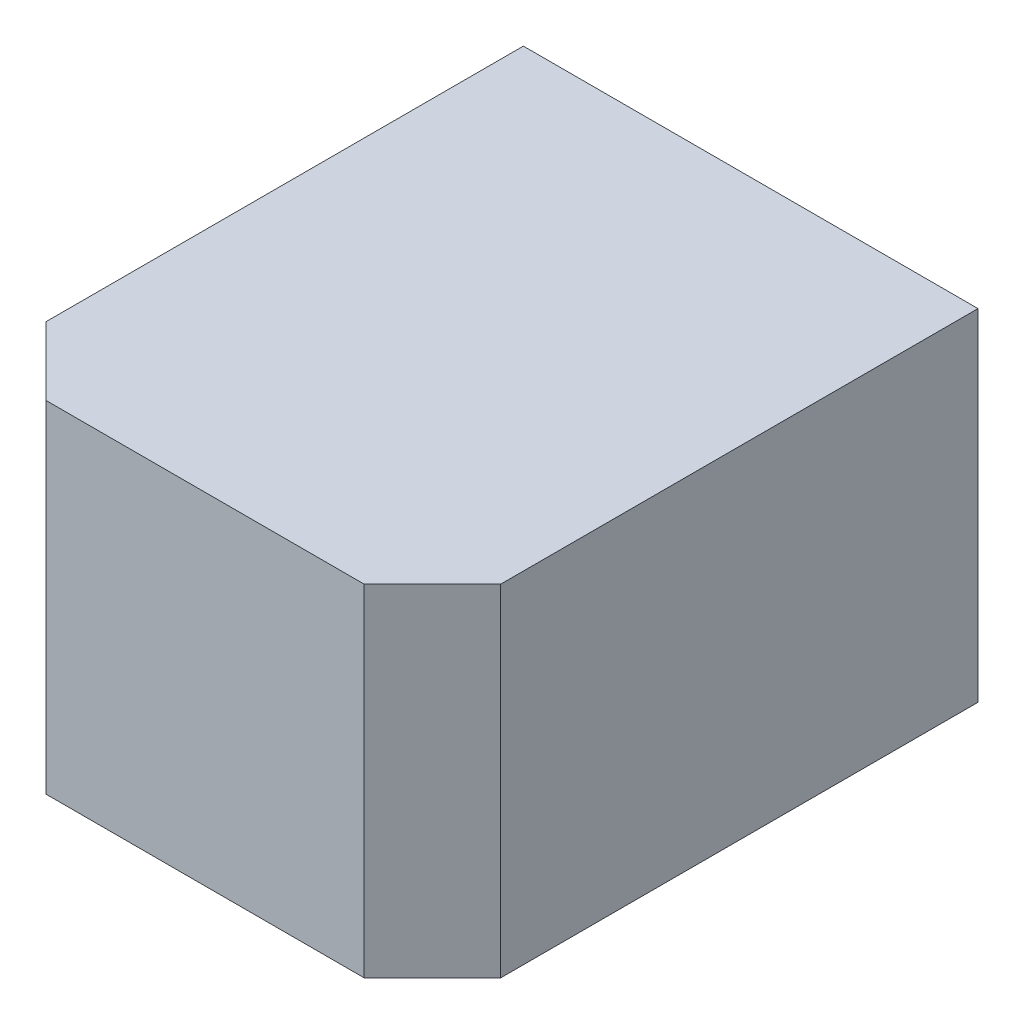
from build123d import *

# Parameters (mm, degrees)
SKETCH1_W           = 20
SKETCH1_H           = 15
BOSS_EXTRUDE1_DEPTH = 24
CHAMFER2_SIZE       = 3
CHAMFER3_SIZE       = 3
CUT_EXTRUDE1_DEPTH  = 10


with BuildPart() as part:
    # Sketch1 → Boss-Extrude1 (new body)
    with BuildSketch(Plane.XY):
        Rectangle(SKETCH1_W, SKETCH1_H)
    extrude(amount=BOSS_EXTRUDE1_DEPTH)

    # Chamfer2
    chamfer2_edges = [part.edges().sort_by_distance(p)[0] for p in [
        (10, 0, 24),
    ]]
    chamfer(chamfer2_edges, length=CHAMFER2_SIZE)

    # Chamfer3
    chamfer3_edges = [part.edges().sort_by_distance(p)[0] for p in [
        (-10, 0, 24),
    ]]
    chamfer(chamfer3_edges, length=CHAMFER3_SIZE)

    # Sketch3 → Cut-Extrude1 (cut)
    with BuildSketch(Plane(origin=(0, 0, 0), x_dir=(-1, 0, 0), z_dir=(0, 0, -1))):
        with BuildLine():
            Line((3.122498999, 2.5), (3.122498999, -2.5))
            ThreePointArc((3.122498999, -2.5), (-4, 0), (3.122498999, 2.5))
        make_face()
    extrude(amount=-CUT_EXTRUDE1_DEPTH, mode=Mode.SUBTRACT)


solid = part.part
